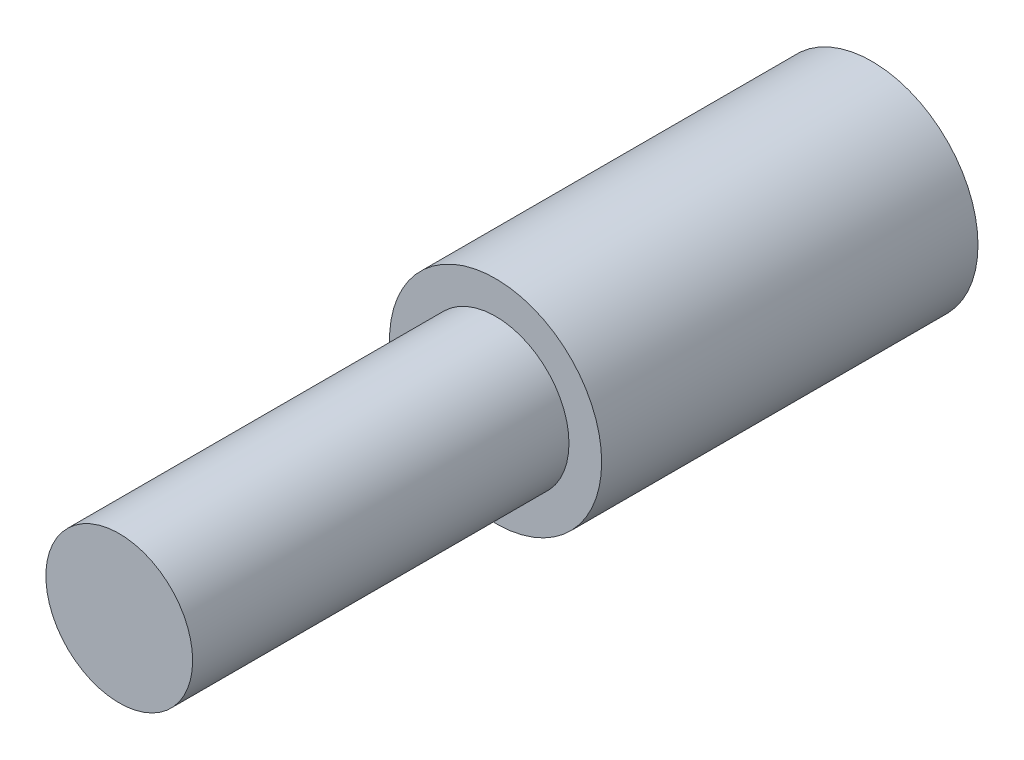
from build123d import *

# Parameters (mm, degrees)
SKETCH_1_R      = 3.9
EXTRUDE_1_DEPTH = 20
SKETCH_2_R      = 5.636785761
SKETCH_2_R_2    = 2.651196968
EXTRUDE_2_DEPTH = 20


with BuildPart() as part:
    # 스케치1 → 보스-돌출1 (new body)
    with BuildSketch(Plane.XY):
        Circle(SKETCH_1_R)
    extrude(amount=EXTRUDE_1_DEPTH)

    # 스케치2 → 보스-돌출2 (add)
    with BuildSketch(Plane.XY):
        Circle(SKETCH_2_R)
        Circle(SKETCH_2_R_2, mode=Mode.SUBTRACT)
    extrude(amount=-EXTRUDE_2_DEPTH)


solid = part.part
